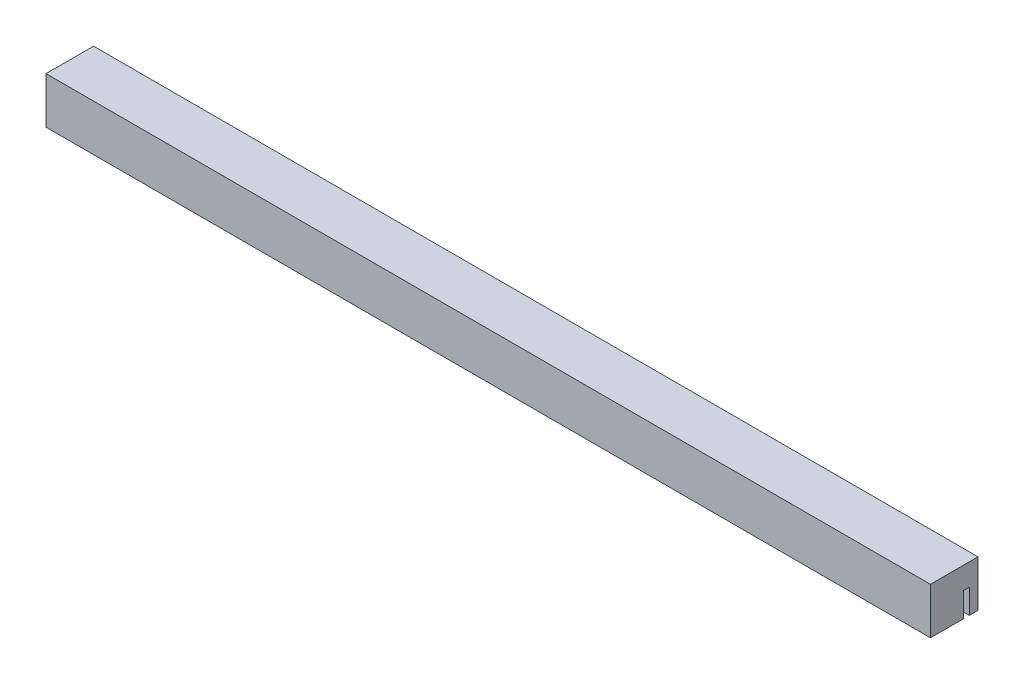
from build123d import *

# Parameters (mm, degrees)
SKETCH1_W           = 193.675
SKETCH1_H           = 10.16
BOSS_EXTRUDE1_DEPTH = 5.08
SKETCH2_W           = 193.675
SKETCH2_H           = 1.27
CUT_EXTRUDE1_DEPTH  = 5.334
SKETCH3_W           = 193.675
SKETCH3_H           = 10.16
BOSS_EXTRUDE2_DEPTH = 5.334


with BuildPart() as part:
    # Sketch1 → Boss-Extrude1 (new body)
    with BuildSketch(Plane.XY):
        Rectangle(SKETCH1_W, SKETCH1_H)
    extrude(amount=BOSS_EXTRUDE1_DEPTH)

    # Sketch2 → Cut-Extrude1 (cut)
    with BuildSketch(Plane.XZ.offset(5.08)):
        with Locations((0, 2.54)):
            Rectangle(SKETCH2_W, SKETCH2_H)
    extrude(amount=-CUT_EXTRUDE1_DEPTH, mode=Mode.SUBTRACT)

    # Sketch3 → Boss-Extrude2 (add)
    with BuildSketch(Plane.XY.offset(5.08)):
        Rectangle(SKETCH3_W, SKETCH3_H)
    extrude(amount=BOSS_EXTRUDE2_DEPTH)


solid = part.part
